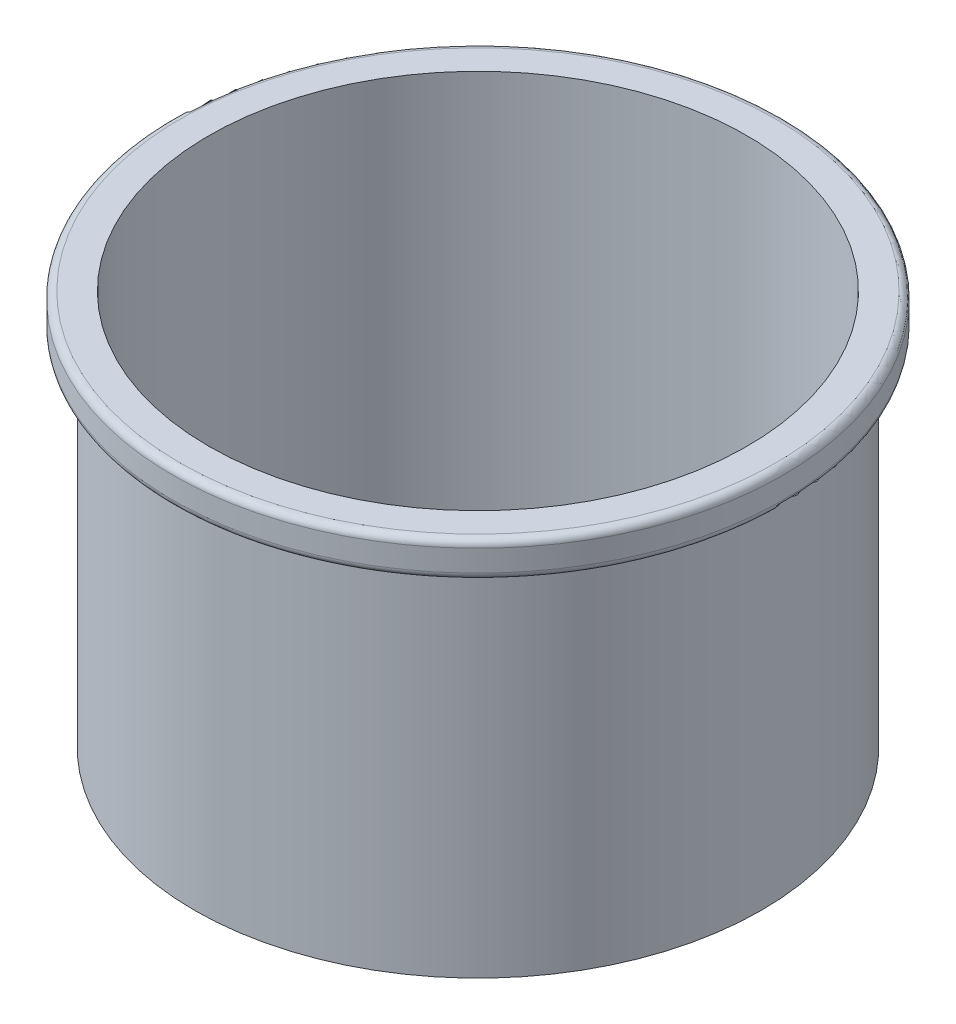
from build123d import *

# Parameters (mm, degrees)
SKETCH1_R           = 79
BOSS_EXTRUDE1_DEPTH = 110
SHELL1_T            = -4


with BuildPart() as part:
    # Sketch1 → Boss-Extrude1 (new body)
    with BuildSketch(Plane(origin=(0, 0, 0), x_dir=(1, 0, 0), z_dir=(0, 1, 0))):
        with Locations(Location((0, 0, 0), (0, 0, 270))):
            Circle(SKETCH1_R)
    extrude(amount=BOSS_EXTRUDE1_DEPTH)

    # Shell1
    shell1_openings = [part.faces().sort_by_distance(p)[0] for p in [
        (0, 110, 0),
    ]]
    offset(amount=SHELL1_T, openings=shell1_openings, kind=Kind.INTERSECTION)

    # Sketch2 → Revolve1 (revolve)
    with BuildSketch(Plane(origin=(0, 0, 0), x_dir=(0, 0, -1), z_dir=(1, 0, 0))):
        with BuildLine():
            Line((79, 110), (83, 110))
            ThreePointArc((83, 110), (84.414213562, 109.414213562), (85, 108))
            Line((85, 108), (85, 102))
            ThreePointArc((85, 102), (84.414213562, 100.585786438), (83, 100))
            Line((83, 100), (79, 100))
            Line((79, 100), (79, 110))
        make_face()
    revolve(axis=Axis((0, -5.5, 0), (0, 1, 0)))


solid = part.part
